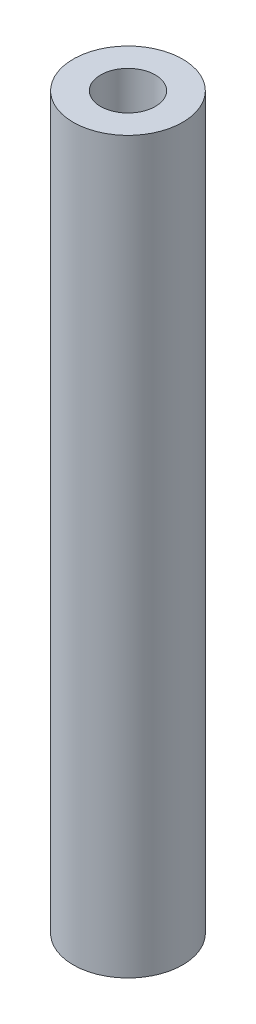
from build123d import *

# Parameters (mm, degrees)
SKETCH1_R           = 3
BOSS_EXTRUDE1_DEPTH = 40
SKETCH6_R           = 1.5
CUT_EXTRUDE1_DEPTH  = 41.224370722


with BuildPart() as part:
    # Sketch1 → Boss-Extrude1 (new body)
    with BuildSketch(Plane(origin=(0, 0, 0), x_dir=(1, 0, 0), z_dir=(0, 1, 0))):
        with Locations(Location((0, 0, 0), (0, 0, 270))):
            Circle(SKETCH1_R)
    extrude(amount=BOSS_EXTRUDE1_DEPTH)

    # Sketch6 → Cut-Extrude1 (cut, through all)
    with BuildSketch(Plane(origin=(0, 40, 0), x_dir=(1, 0, 0), z_dir=(0, 1, 0))):
        with Locations(Location((0, 0, 0), (0, 0, 270))):
            Circle(SKETCH6_R)
    extrude(amount=-CUT_EXTRUDE1_DEPTH, mode=Mode.SUBTRACT)


solid = part.part
